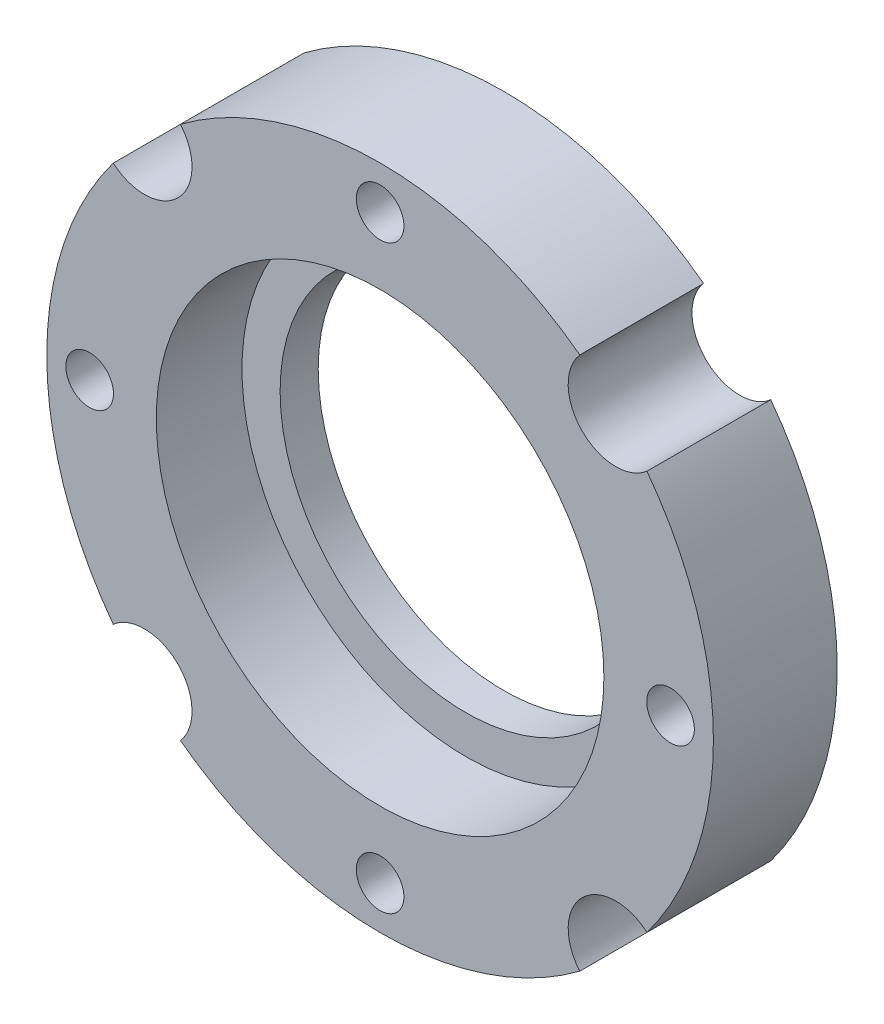
from build123d import *

# Parameters (mm, degrees)
SZKIC1_R                    = 35
SZKIC1_R_2                  = 30.5
SZKIC1_R_3                  = 19.5
DODANIE_WYCI_GNI_CIE1_DEPTH = 13
OTWORY_USTALAJ_CE_5_0MM1_D  = 5
WYTNIJ_WYCI_GNI_CIE1_START  = -9
SZKIC6_R                    = 23.5
SZKIC6_R_2                  = 19.5
WYTNIJ_WYCI_GNI_CIE1_DEPTH  = 9
SZKIC2_R                    = 5
WYTNIJ_WYCI_GNI_CIE2_DEPTH  = 14


with BuildPart() as part:
    # Szkic1 → Dodanie-wyciągnięcie1 (new body)
    # profile 1 of 2: a face of its own
    with BuildSketch(Plane.XY):
        with Locations(Location((0, 0, 0), (0, 0, 180))):
            Circle(SZKIC1_R)
        Circle(SZKIC1_R_2, mode=Mode.SUBTRACT)
    # profile 2 of 2: a face of its own
    with BuildSketch(Plane.XY):
        Circle(SZKIC1_R_2)
        with Locations(Location((0, 0, 0), (0, 0, 180))):
            Circle(SZKIC1_R_3, mode=Mode.SUBTRACT)
    extrude(amount=DODANIE_WYCI_GNI_CIE1_DEPTH)

    # Otwory ustalające Ø5.0mm1 (through all)
    with Locations(Plane.XY.offset(13)):
        with Locations((0, 30.5), (0, -30.5), (-30.5, 0), (30.5, 0)):
            Hole(OTWORY_USTALAJ_CE_5_0MM1_D / 2)

    # Szkic6 → Wytnij-wyciągnięcie1 (cut)
    with BuildSketch(Plane.XY.offset(13).offset(WYTNIJ_WYCI_GNI_CIE1_START)):
        Circle(SZKIC6_R)
        with Locations(Location((0, 0, 0), (0, 0, 180))):
            Circle(SZKIC6_R_2, mode=Mode.SUBTRACT)
    extrude(amount=WYTNIJ_WYCI_GNI_CIE1_DEPTH, mode=Mode.SUBTRACT)

    # Szkic2 → Wytnij-wyciągnięcie2 (cut)
    with BuildSketch(Plane.XY.offset(13)):
        with Locations((24.748737342, 24.748737342)):
            Circle(SZKIC2_R)
        with Locations((24.748737342, -24.748737342)):
            Circle(SZKIC2_R)
        with Locations((-24.748737342, -24.748737342)):
            Circle(SZKIC2_R)
        with Locations((-24.748737342, 24.748737342)):
            Circle(SZKIC2_R)
    extrude(amount=-WYTNIJ_WYCI_GNI_CIE2_DEPTH, mode=Mode.SUBTRACT)


solid = part.part
